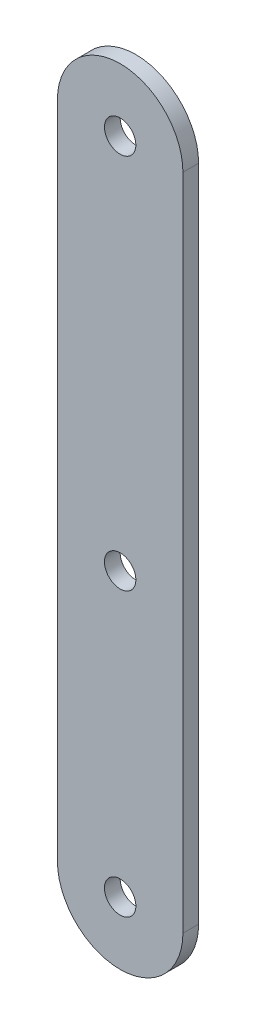
from build123d import *

# Parameters (mm, degrees)
SKETCH1_R           = 12.7
BOSS_EXTRUDE1_DEPTH = 12.7


with BuildPart() as part:
    # Sketch1 → Boss-Extrude1 (new body)
    with BuildSketch(Plane.XY):
        with BuildLine():
            Line((-50.8, -533.4), (-50.8, 0))
            ThreePointArc((-50.8, 0), (0, 50.8), (50.8, 0))
            Line((50.8, 0), (50.8, -533.4))
            ThreePointArc((50.8, -533.4), (0, -584.2), (-50.8, -533.4))
        make_face()
        Circle(SKETCH1_R, mode=Mode.SUBTRACT)
        with Locations((0, -533.4)):
            Circle(SKETCH1_R, mode=Mode.SUBTRACT)
        with Locations((0, -304.8)):
            Circle(SKETCH1_R, mode=Mode.SUBTRACT)
    extrude(amount=BOSS_EXTRUDE1_DEPTH)


solid = part.part
